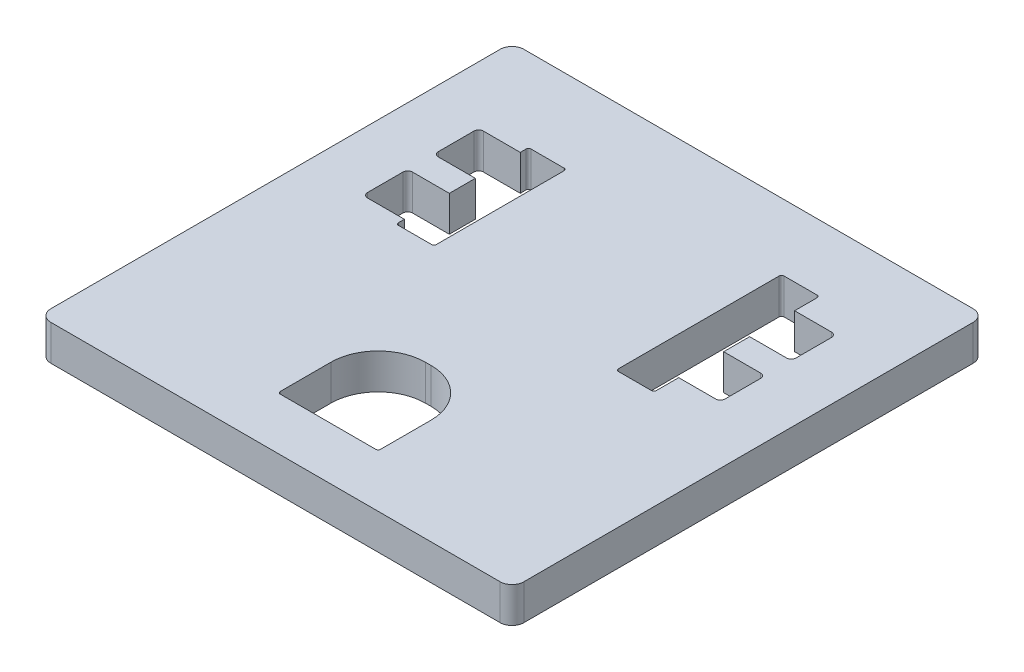
from build123d import *

# Parameters (mm, degrees)
BOSS_EXTRUDE1_DEPTH = 1.905
CUT_EXTRUDE1_DEPTH  = 36.971502957


with BuildPart() as part:
    # Sketch1 → Boss-Extrude1 (new body)
    with BuildSketch(Plane(origin=(0, 0, 0), x_dir=(1, 0, 0), z_dir=(0, 1, 0))):
        with BuildLine():
            Line((0.635, 0), (24.765, 0))
            ThreePointArc((24.765, 0), (25.214012806, 0.185987194), (25.4, 0.635))
            Line((25.4, 0.635), (25.4, 24.765))
            ThreePointArc((25.4, 24.765), (25.214012806, 25.214012806), (24.765, 25.4))
            Line((24.765, 25.4), (0.635, 25.4))
            ThreePointArc((0.635, 25.4), (0.185987194, 25.214012806), (0, 24.765))
            Line((0, 24.765), (0, 0.635))
            ThreePointArc((0, 0.635), (0.185987194, 0.185987194), (0.635, 0))
        make_face()
    extrude(amount=BOSS_EXTRUDE1_DEPTH)

    # Sketch2 → Cut-Extrude1 (cut, through all)
    with BuildSketch(Plane(origin=(0, 1.905, 0), x_dir=(1, 0, 0), z_dir=(0, 1, 0))):
        with BuildLine():
            Line((10.1346, 2.8194), (15.2654, 2.8194))
            ThreePointArc((15.2654, 2.8194), (15.355202561, 2.856597439), (15.3924, 2.9464))
            Line((15.3924, 2.9464), (15.3924, 5.6642))
            ThreePointArc((15.3924, 5.6642), (14.648451224, 7.460251224), (12.8524, 8.2042))
            Line((12.8524, 8.2042), (12.5476, 8.2042))
            ThreePointArc((12.5476, 8.2042), (10.751548776, 7.460251224), (10.0076, 5.6642))
            Line((10.0076, 5.6642), (10.0076, 2.9464))
            ThreePointArc((10.0076, 2.9464), (10.044797439, 2.856597439), (10.1346, 2.8194))
        make_face()
        with BuildLine():
            Line((5.461, 20.955), (7.239, 20.955))
            ThreePointArc((7.239, 20.955), (7.328802561, 20.917802561), (7.366, 20.828))
            Line((7.366, 20.828), (7.366, 13.97))
            ThreePointArc((7.366, 13.97), (7.328802561, 13.880197439), (7.239, 13.843))
            Line((7.239, 13.843), (5.461, 13.843))
            ThreePointArc((5.461, 13.843), (5.371197439, 13.880197439), (5.334, 13.97))
            Line((5.334, 13.97), (5.334, 14.2875))
            Line((5.334, 14.2875), (3.3528, 14.2875))
            ThreePointArc((3.3528, 14.2875), (3.173194878, 14.361894878), (3.0988, 14.5415))
            Line((3.0988, 14.5415), (3.0988, 16.4465))
            ThreePointArc((3.0988, 16.4465), (3.173194878, 16.626105122), (3.3528, 16.7005))
            Line((3.3528, 16.7005), (5.334, 16.7005))
            Line((5.334, 16.7005), (5.334, 18.0975))
            Line((5.334, 18.0975), (3.3528, 18.0975))
            ThreePointArc((3.3528, 18.0975), (3.173194878, 18.171894878), (3.0988, 18.3515))
            Line((3.0988, 18.3515), (3.0988, 20.2565))
            ThreePointArc((3.0988, 20.2565), (3.173194878, 20.436105122), (3.3528, 20.5105))
            Line((3.3528, 20.5105), (5.334, 20.5105))
            Line((5.334, 20.5105), (5.334, 20.828))
            ThreePointArc((5.334, 20.828), (5.371197439, 20.917802561), (5.461, 20.955))
        make_face()
        with BuildLine():
            Line((18.161, 21.844), (19.939, 21.844))
            ThreePointArc((19.939, 21.844), (20.028802561, 21.806802561), (20.066, 21.717))
            Line((20.066, 21.717), (20.066, 20.5105))
            Line((20.066, 20.5105), (22.0472, 20.5105))
            ThreePointArc((22.0472, 20.5105), (22.226805122, 20.436105122), (22.3012, 20.2565))
            Line((22.3012, 20.2565), (22.3012, 18.3515))
            ThreePointArc((22.3012, 18.3515), (22.226805122, 18.171894878), (22.0472, 18.0975))
            Line((22.0472, 18.0975), (20.066, 18.0975))
            Line((20.066, 18.0975), (20.066, 16.7005))
            Line((20.066, 16.7005), (22.0472, 16.7005))
            ThreePointArc((22.0472, 16.7005), (22.226805122, 16.626105122), (22.3012, 16.4465))
            Line((22.3012, 16.4465), (22.3012, 14.5415))
            ThreePointArc((22.3012, 14.5415), (22.226805122, 14.361894878), (22.0472, 14.2875))
            Line((22.0472, 14.2875), (20.066, 14.2875))
            Line((20.066, 14.2875), (20.066, 13.081))
            ThreePointArc((20.066, 13.081), (20.028802561, 12.991197439), (19.939, 12.954))
            Line((19.939, 12.954), (18.161, 12.954))
            ThreePointArc((18.161, 12.954), (18.071197439, 12.991197439), (18.034, 13.081))
            Line((18.034, 13.081), (18.034, 21.717))
            ThreePointArc((18.034, 21.717), (18.071197439, 21.806802561), (18.161, 21.844))
        make_face()
    extrude(amount=-CUT_EXTRUDE1_DEPTH, mode=Mode.SUBTRACT)


solid = part.part
